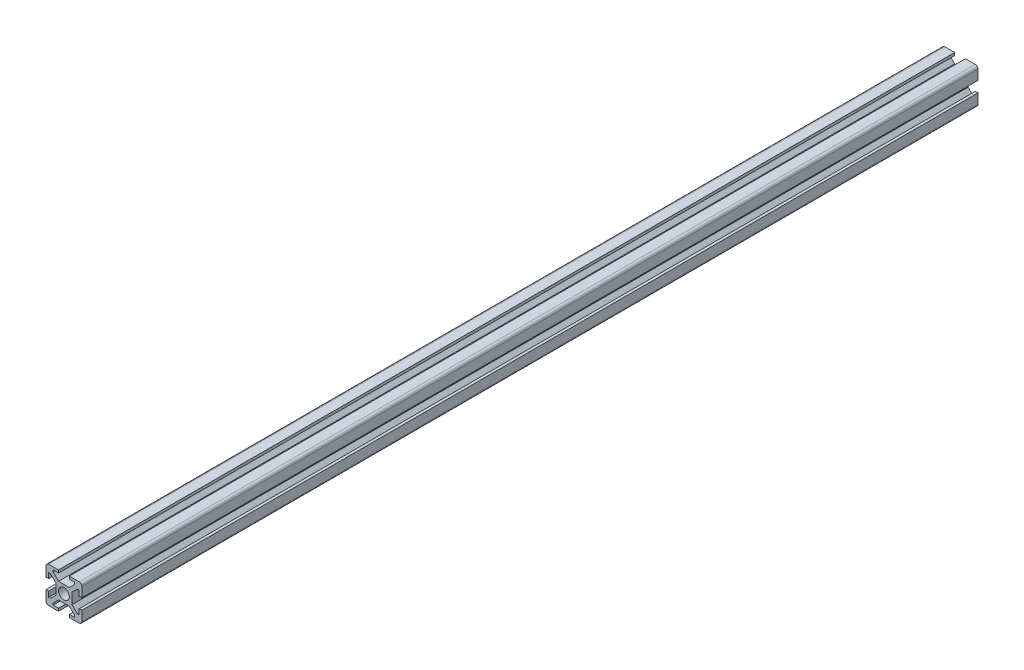
from build123d import *

# Parameters (mm, degrees)
ESQUISSE1_W                  = 20
ESQUISSE1_H                  = 20
EXTRUSION1_DEPTH             = 250
CONG_1_R                     = 1.5
ENL_V_MAT_EXTRU_1_DEPTH      = 501.199960016
R_P_TITION_CIRCULAIRE1_COUNT = 4


with BuildPart() as part:
    # Esquisse1 → Extrusion1 (new, symmetric)
    with BuildSketch(Plane.XY):
        Rectangle(ESQUISSE1_W, ESQUISSE1_H)
    extrude(amount=EXTRUSION1_DEPTH, both=True)

    # Congé1
    cong_1_edges = [part.edges().sort_by_distance(p)[0] for p in [
        (-10, -10, 0),
        (10, -10, 0),
        (-10, 10, 0),
        (10, 10, 0),
    ]]
    fillet(cong_1_edges, radius=CONG_1_R)

    # Esquisse2 → Enlèv. mat.-Extru.1 (cut, through all)
    with BuildSketch(Plane(origin=(0, 0, -250), x_dir=(-1, 0, 0), z_dir=(0, 0, -1))):
        Polygon((-10, 3), (-10, -3), (-8.5, -3), (-8.5, -6), (-7.5, -6), (-4.5, -3), (-4.5, 3), (-7.5, 6), (-8.5, 6), (-8.5, 3), align=None)
    enl_v_mat_extru_1 = extrude(amount=-ENL_V_MAT_EXTRU_1_DEPTH, mode=Mode.SUBTRACT)

    # Répétition circulaire1: Enlèv. mat.-Extru.1 ×4 about axis
    r_p_tition_circulaire1_axis = Axis((0, 0, 9.333809512), (0, 0, -1))
    for i in range(1, R_P_TITION_CIRCULAIRE1_COUNT):
        add(enl_v_mat_extru_1.rotate(r_p_tition_circulaire1_axis, i * 360 / R_P_TITION_CIRCULAIRE1_COUNT), mode=Mode.SUBTRACT)

    # Esquisse5 → Trou taraudé M6x1.01 (revolve, cut)
    with BuildSketch(Plane(origin=(0, 0, -250), x_dir=(0, 1, 0), z_dir=(1, 0, 0))):
        Polygon((0, 0), (0, 31.502151548), (2.5, 30), (2.5, 24), (3, 24), (3, 0), align=None)
    trou_taraud_m6x1_01 = revolve(axis=Axis((0, 0, -256.35), (0, 0, 1)), mode=Mode.SUBTRACT)

    # Symétrie1: Trou taraudé M6x1.01 across plane
    add(trou_taraud_m6x1_01.mirror(Plane.XY), mode=Mode.SUBTRACT)


solid = part.part
